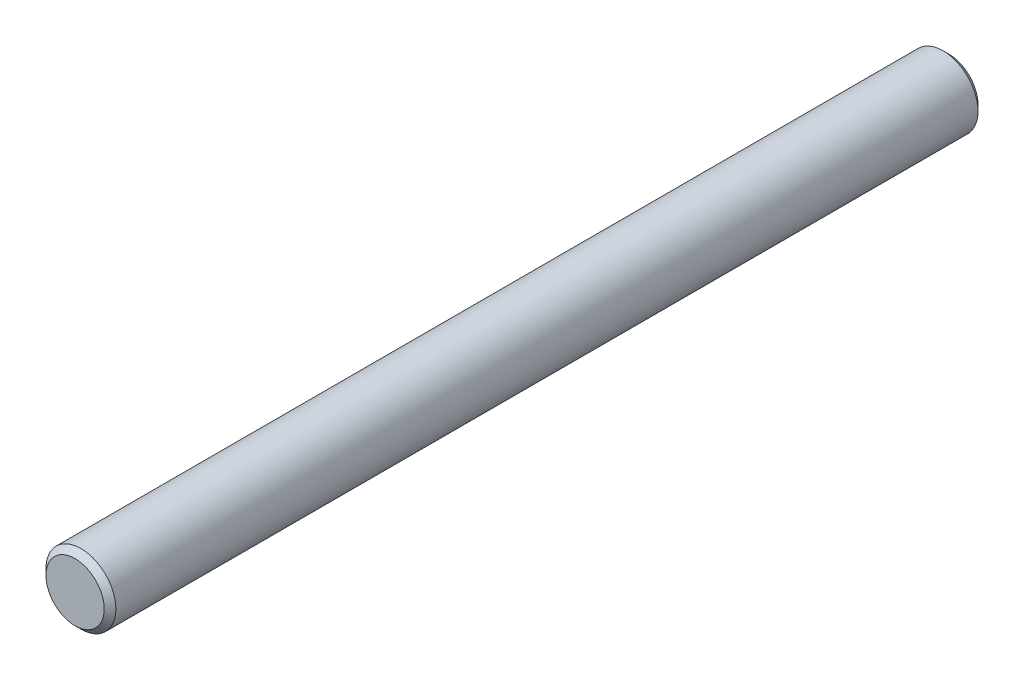
from build123d import *

# Parameters (mm, degrees)
SKETCH_1_R      = 3
EXTRUDE_1_DEPTH = 37.5
CHAMFER_1_SIZE  = 0.5


with BuildPart() as part:
    # 草图1 → 凸台-拉伸1 (new, symmetric)
    with BuildSketch(Plane.XY):
        Circle(SKETCH_1_R)
    extrude(amount=EXTRUDE_1_DEPTH, both=True)

    # 倒角1
    chamfer_1_edges = [part.edges().sort_by_distance(p)[0] for p in [
        (-3, 0, -37.5),
        (-3, 0, 37.5),
    ]]
    chamfer(chamfer_1_edges, length=CHAMFER_1_SIZE)


solid = part.part
